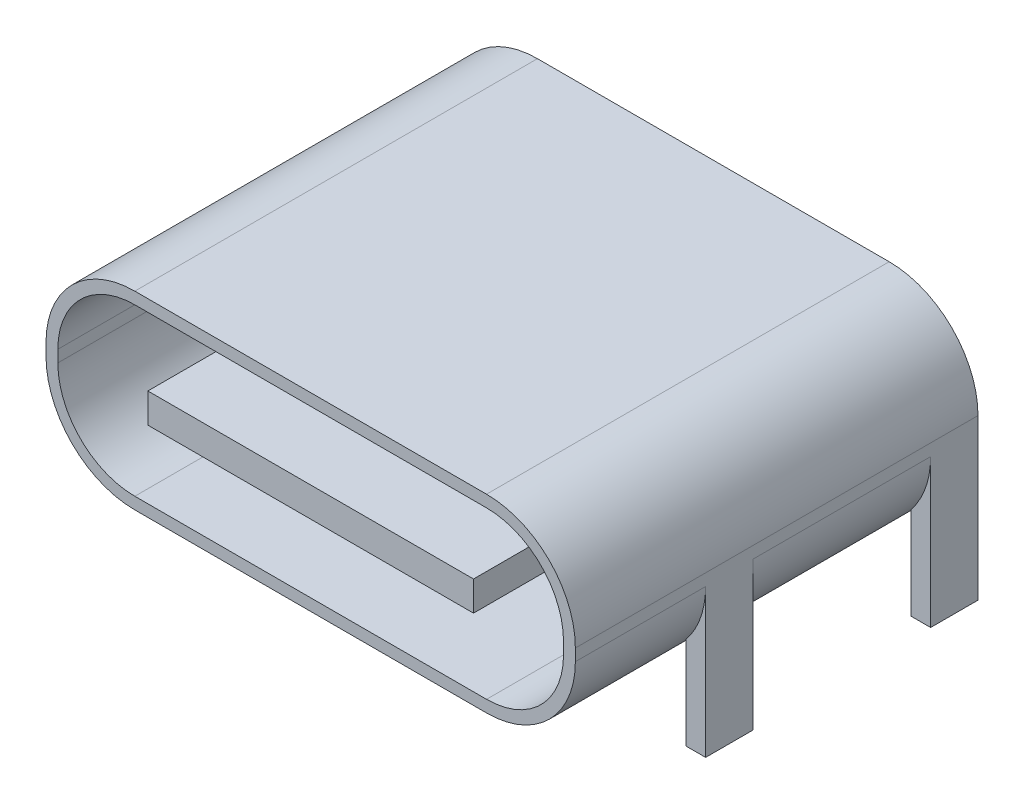
from build123d import *

# Parameters (mm, degrees)
BOSS_EXTRUDE1_DEPTH             = 6.8
BOSS_EXTRUDE2_REACH             = 10.744
SKETCH2_W                       = 0.335114676
SKETCH2_H                       = 0.8
BOSS_EXTRUDE2_DIRECTION_2_DEPTH = 1
SKETCH3_W                       = 5.5
SKETCH3_H                       = 0.5
CUT_EXTRUDE1_DEPTH              = 5


with BuildPart() as part:
    # Sketch1 → Boss-Extrude1 (new body)
    with BuildSketch(Plane.XY):
        with BuildLine():
            Line((-2.97, 1.6), (2.97, 1.6))
            ThreePointArc((2.97, 1.6), (4.030660172, 1.160660172), (4.47, 0.1))
            Line((4.47, 0.1), (4.47, -0.1))
            ThreePointArc((4.47, -0.1), (4.030660172, -1.160660172), (2.97, -1.6))
            Line((2.97, -1.6), (-2.97, -1.6))
            ThreePointArc((-2.97, -1.6), (-4.030660172, -1.160660172), (-4.47, -0.1))
            Line((-4.47, -0.1), (-4.47, 0.1))
            ThreePointArc((-4.47, 0.1), (-4.030660172, 1.160660172), (-2.97, 1.6))
        make_face()
    extrude(amount=BOSS_EXTRUDE1_DEPTH)

    # Sketch2 → Boss-Extrude2 (add, up to next)
    with BuildSketch(Plane.XZ.offset(1.6), mode=Mode.PRIVATE) as boss_extrude2_sk1:
        with Locations((-4.302442662, 4.2)):
            Rectangle(SKETCH2_W, SKETCH2_H)
    boss_extrude2_tool1 = extrude(boss_extrude2_sk1.sketch, amount=-BOSS_EXTRUDE2_REACH, mode=Mode.PRIVATE) - part.part
    # Sketch2 → Boss-Extrude2 (add, up to next)
    with BuildSketch(Plane.XZ.offset(1.6), mode=Mode.PRIVATE) as boss_extrude2_sk2:
        with Locations((-4.302442662, 0.4)):
            Rectangle(SKETCH2_W, SKETCH2_H)
    boss_extrude2_tool2 = extrude(boss_extrude2_sk2.sketch, amount=-BOSS_EXTRUDE2_REACH, mode=Mode.PRIVATE) - part.part
    # Sketch2 → Boss-Extrude2 (add, up to next)
    with BuildSketch(Plane.XZ.offset(1.6), mode=Mode.PRIVATE) as boss_extrude2_sk3:
        with Locations((4.302442662, 0.4)):
            Rectangle(SKETCH2_W, SKETCH2_H)
    boss_extrude2_tool3 = extrude(boss_extrude2_sk3.sketch, amount=-BOSS_EXTRUDE2_REACH, mode=Mode.PRIVATE) - part.part
    # Sketch2 → Boss-Extrude2 (add, up to next)
    with BuildSketch(Plane.XZ.offset(1.6), mode=Mode.PRIVATE) as boss_extrude2_sk4:
        with Locations((4.302442662, 4.2)):
            Rectangle(SKETCH2_W, SKETCH2_H)
    boss_extrude2_tool4 = extrude(boss_extrude2_sk4.sketch, amount=-BOSS_EXTRUDE2_REACH, mode=Mode.PRIVATE) - part.part
    add(boss_extrude2_tool1.solids().sort_by_distance((-4.302443, -1.6, 4.2))[0])
    add(boss_extrude2_tool2.solids().sort_by_distance((-4.302443, -1.6, 0.4))[0])
    add(boss_extrude2_tool3.solids().sort_by_distance((4.302443, -1.6, 0.4))[0])
    add(boss_extrude2_tool4.solids().sort_by_distance((4.302443, -1.6, 4.2))[0])

    # Sketch2 → Boss-Extrude2 direction 2 (add)
    with BuildSketch(Plane.XZ.offset(1.6)):
        with Locations((-4.302442662, 4.2)):
            Rectangle(SKETCH2_W, SKETCH2_H)
        with Locations((-4.302442662, 0.4)):
            Rectangle(SKETCH2_W, SKETCH2_H)
        with Locations((4.302442662, 0.4)):
            Rectangle(SKETCH2_W, SKETCH2_H)
        with Locations((4.302442662, 4.2)):
            Rectangle(SKETCH2_W, SKETCH2_H)
    extrude(amount=BOSS_EXTRUDE2_DIRECTION_2_DEPTH)

    # Sketch3 → Cut-Extrude1 (cut)
    with BuildSketch(Plane.XY.offset(6.8)):
        with BuildLine():
            Line((-2.97, -1.4), (2.97, -1.4))
            ThreePointArc((2.97, -1.4), (3.889238816, -1.019238816), (4.27, -0.1))
            Line((4.27, -0.1), (4.27, 0.1))
            ThreePointArc((4.27, 0.1), (3.889238816, 1.019238816), (2.97, 1.4))
            Line((2.97, 1.4), (-2.97, 1.4))
            ThreePointArc((-2.97, 1.4), (-3.889238816, 1.019238816), (-4.27, 0.1))
            Line((-4.27, 0.1), (-4.27, -0.1))
            ThreePointArc((-4.27, -0.1), (-3.889238816, -1.019238816), (-2.97, -1.4))
        make_face()
        Rectangle(SKETCH3_W, SKETCH3_H, mode=Mode.SUBTRACT)
    extrude(amount=-CUT_EXTRUDE1_DEPTH, mode=Mode.SUBTRACT)


solid = part.part
